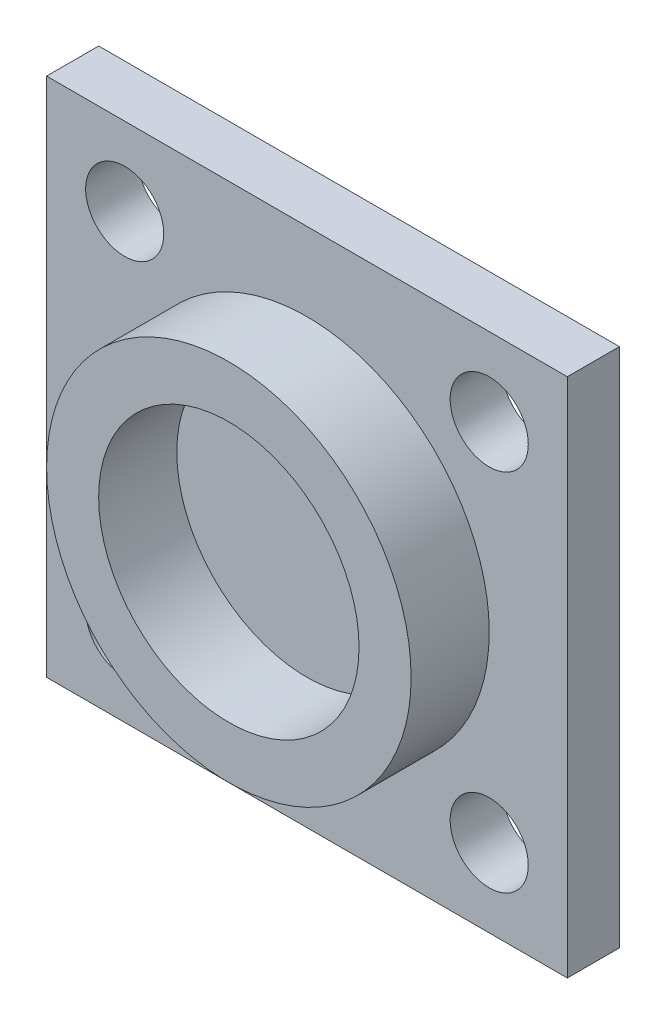
from build123d import *

# Parameters (mm, degrees)
SKETCH_1_W      = 20
SKETCH_1_H      = 20
SKETCH_1_R      = 1.5
EXTRUDE_1_DEPTH = 2
SKETCH_2_R      = 7
SKETCH_2_R_2    = 5
EXTRUDE_2_DEPTH = 3


with BuildPart() as part:
    # 草图1 → 凸台-拉伸1 (new body)
    with BuildSketch(Plane.XY):
        Rectangle(SKETCH_1_W, SKETCH_1_H)
        with Locations((-7, 7)):
            Circle(SKETCH_1_R, mode=Mode.SUBTRACT)
        with Locations((7, 7)):
            Circle(SKETCH_1_R, mode=Mode.SUBTRACT)
        with Locations((7, -7)):
            Circle(SKETCH_1_R, mode=Mode.SUBTRACT)
        with Locations((-7, -7)):
            Circle(SKETCH_1_R, mode=Mode.SUBTRACT)
    extrude(amount=EXTRUDE_1_DEPTH)

    # 草图2 → 凸台-拉伸2 (add)
    with BuildSketch(Plane.XY.offset(2)):
        Circle(SKETCH_2_R)
        Circle(SKETCH_2_R_2, mode=Mode.SUBTRACT)
    extrude(amount=EXTRUDE_2_DEPTH)


solid = part.part
